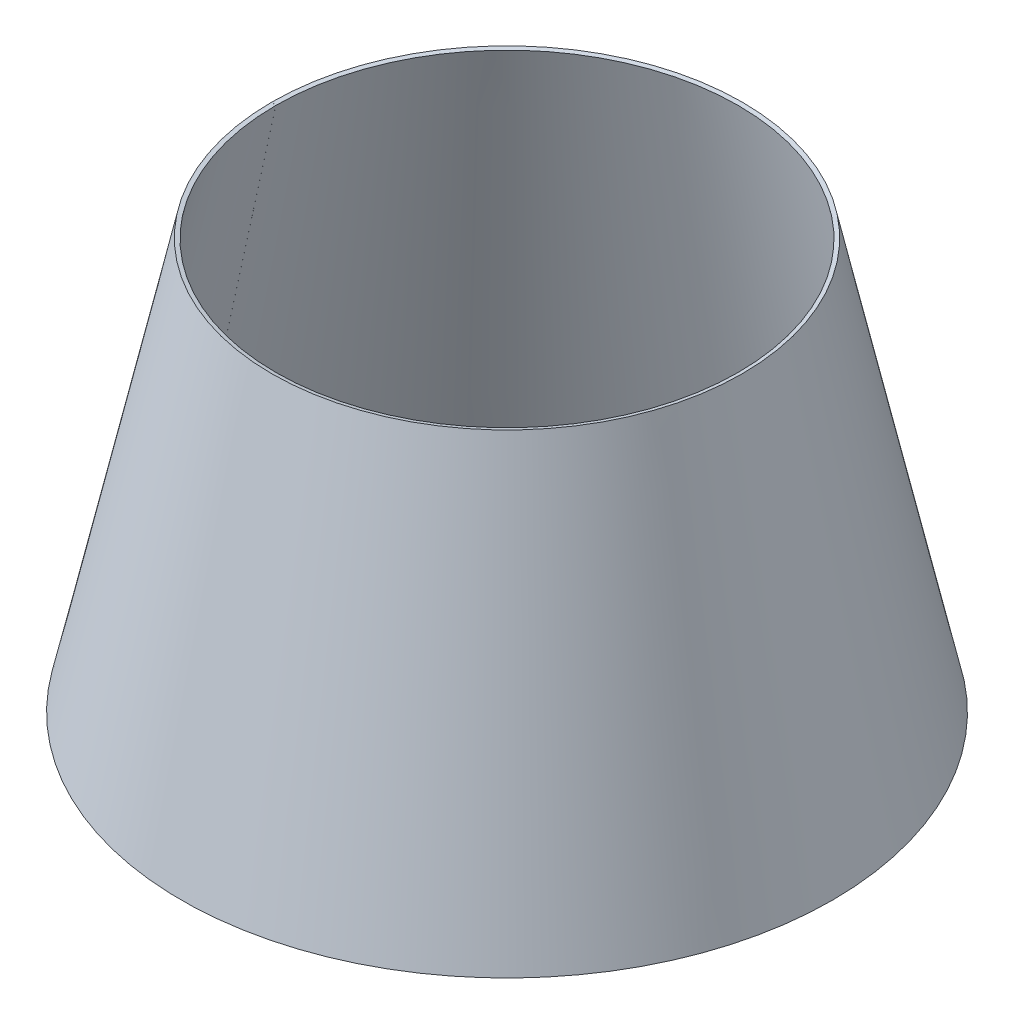
from build123d import *

# Parameters (mm, degrees)
REVOLVE1_ANGLE = 359.99


with BuildPart() as part:
    # Sketch1 → Revolve1 (revolve)
    with BuildSketch(Plane.XY):
        Polygon((-33.8636, 0), (-24.35, 43.25), (-24.771717945, 43.342764297), (-34.285317945, 0.092764297), align=None)
    revolve(axis=Axis((0, 0, 0), (0, 1, 0)), revolution_arc=REVOLVE1_ANGLE)


solid = part.part
